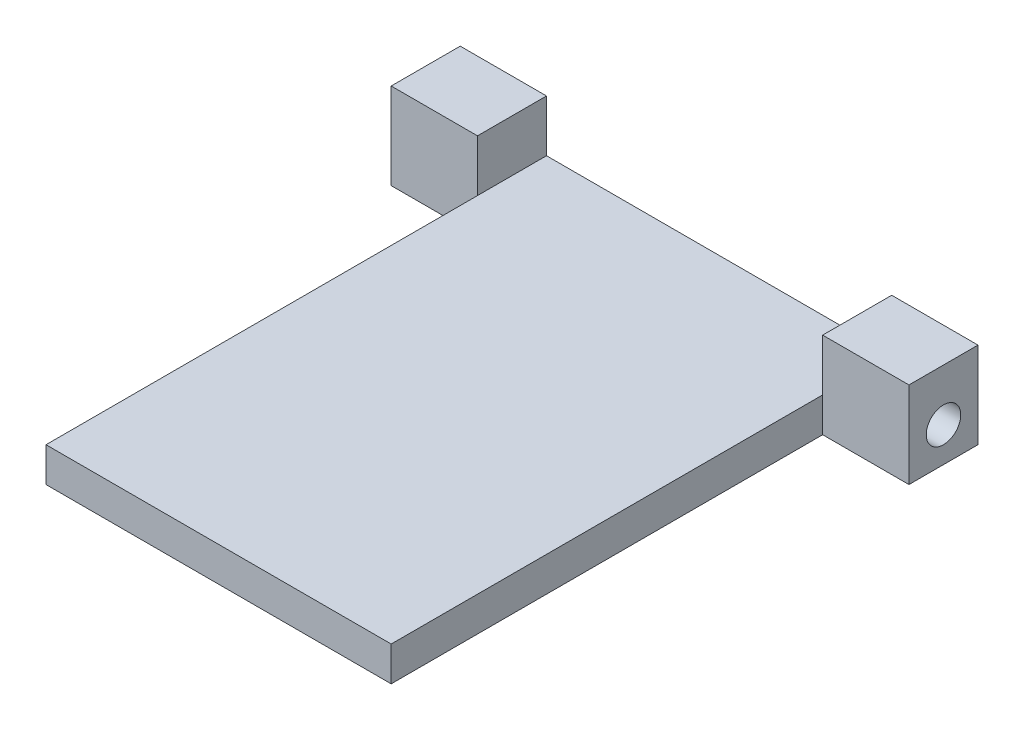
from build123d import *

# Parameters (mm, degrees)
SKETCH5_W           = 100
SKETCH5_H           = 170
BOSS_EXTRUDE2_DEPTH = 10
SKETCH7_W           = 20
SKETCH7_H           = 25
BOSS_EXTRUDE3_DEPTH = 25
SKETCH8_W           = 20
SKETCH8_H           = 25
BOSS_EXTRUDE4_DEPTH = 25
SKETCH11_R          = 5
CUT_EXTRUDE1_DEPTH  = 20
CUT_EXTRUDE2_START  = -20
SKETCH12_R          = 5
CUT_EXTRUDE2_DEPTH  = 20
SKETCH17_W          = 100
SKETCH17_H          = 10
BOSS_EXTRUDE6_DEPTH = 100
SKETCH18_W          = 100
SKETCH18_H          = 125
CUT_EXTRUDE3_DEPTH  = 10


with BuildPart() as part:
    # Sketch5 → Boss-Extrude2 (new body)
    with BuildSketch(Plane(origin=(0, -50, 0), x_dir=(-1, 0, 0), z_dir=(0, -1, 0))):
        Rectangle(SKETCH5_W, SKETCH5_H)
    extrude(amount=-BOSS_EXTRUDE2_DEPTH)

    # Sketch7 → Boss-Extrude3 (add)
    with BuildSketch(Plane.ZY.offset(50)):
        with Locations((-75, -37.5)):
            Rectangle(SKETCH7_W, SKETCH7_H)
    extrude(amount=BOSS_EXTRUDE3_DEPTH)

    # Sketch8 → Boss-Extrude4 (add)
    with BuildSketch(Plane(origin=(50, 0, 0), x_dir=(0, 0, -1), z_dir=(1, 0, 0))):
        with Locations((75, -37.5)):
            Rectangle(SKETCH8_W, SKETCH8_H)
    extrude(amount=BOSS_EXTRUDE4_DEPTH)

    # Sketch11 → Cut-Extrude1 (cut)
    with BuildSketch(Plane.ZY.offset(75)):
        with Locations((-75, -40)):
            Circle(SKETCH11_R)
    extrude(amount=-CUT_EXTRUDE1_DEPTH, mode=Mode.SUBTRACT)

    # Sketch12 → Cut-Extrude2 (cut)
    with BuildSketch(Plane(origin=(75, 0, 0), x_dir=(0, 0, -1), z_dir=(1, 0, 0)).offset(CUT_EXTRUDE2_START)):
        with Locations(Location((75, -40, 0), (0, 0, 180))):
            Circle(SKETCH12_R)
    extrude(amount=CUT_EXTRUDE2_DEPTH, mode=Mode.SUBTRACT)

    # Sketch17 → Boss-Extrude6 (add)
    with BuildSketch(Plane.XY.offset(85)):
        with Locations((0, -45)):
            Rectangle(SKETCH17_W, SKETCH17_H)
    extrude(amount=BOSS_EXTRUDE6_DEPTH)

    # Sketch18 → Cut-Extrude3 (cut)
    with BuildSketch(Plane(origin=(0, -40, 0), x_dir=(1, 0, 0), z_dir=(0, 1, 0))):
        with Locations((0, -122.5)):
            Rectangle(SKETCH18_W, SKETCH18_H)
    extrude(amount=-CUT_EXTRUDE3_DEPTH, mode=Mode.SUBTRACT)


solid = part.part
